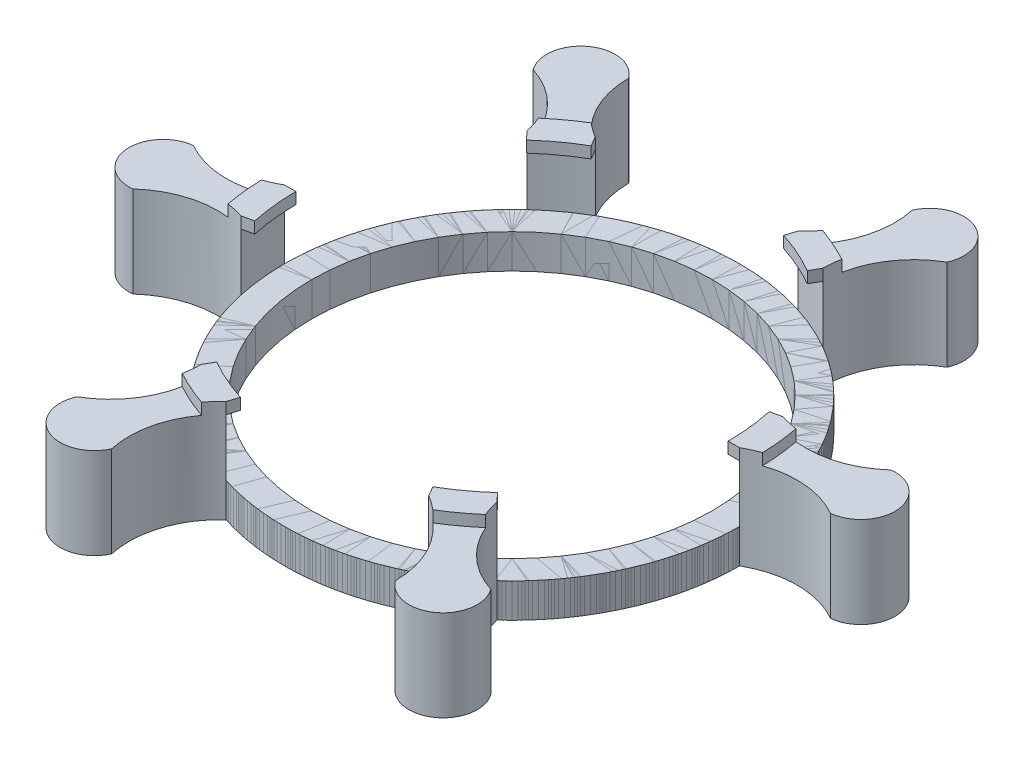
from build123d import *

# Parameters (mm, degrees)
SKETCH1_R                = 63.5
SKETCH1_R_2              = 55.88
BOSS_EXTRUDE1_DEPTH      = 9.525
BOSS_EXTRUDE2_DEPTH      = 15.875
BOSS_EXTRUDE2_DEPTH_BACK = 9.525
BOSS_EXTRUDE3_DEPTH      = 3.175
CIRPATTERN1_COUNT        = 6


with BuildPart() as part:
    # Sketch1 → Boss-Extrude1 (new body)
    with BuildSketch(Plane(origin=(0, 0, 0), x_dir=(1, 0, 0), z_dir=(0, 1, 0))):
        with Locations(Location((0, 0, 0), (0, 0, 90))):
            Circle(SKETCH1_R)
        with Locations(Location((0, 0, 0), (0, 0, 90))):
            Circle(SKETCH1_R_2, mode=Mode.SUBTRACT)
    extrude(amount=BOSS_EXTRUDE1_DEPTH)

    # Sketch2 → Boss-Extrude2 (add, two sides: drawn at the far end of the back side and taken through both)
    with BuildSketch(Plane(origin=(0, 9.525, 0), x_dir=(1, 0, 0), z_dir=(0, 1, 0)).offset(-BOSS_EXTRUDE2_DEPTH_BACK)):
        with BuildLine():
            ThreePointArc((62.042091837, 13.528815193), (75.175517225, 12.909752551), (86.858928571, 18.94034127))
            ThreePointArc((86.858928571, 18.94034127), (97.349634921, 10.490706349), (88.9, 0))
            ThreePointArc((88.9, 0), (76.2, 3.402954744), (63.5, 0))
            ThreePointArc((63.5, 0), (63.1344709, 6.803571429), (62.042091837, 13.528815193))
        make_face()
    extrude(amount=BOSS_EXTRUDE2_DEPTH + BOSS_EXTRUDE2_DEPTH_BACK)

    # Sketch3 → Boss-Extrude3 (add)
    with BuildSketch(Plane(origin=(0, 25.4, 0), x_dir=(1, 0, 0), z_dir=(0, 1, 0))):
        with BuildLine():
            Line((60.325, 0), (63.5, 0))
            ThreePointArc((63.5, 0), (65.659371798, 1.11258817), (67.915149907, 2.013811849))
            ThreePointArc((67.915149907, 2.013811849), (67.553883863, 7.279821429), (66.784920566, 12.501896255))
            ThreePointArc((66.784920566, 12.501896255), (64.388925587, 12.901830068), (62.042091837, 13.528815193))
            Line((62.042091837, 13.528815193), (58.939987245, 12.852374433))
            ThreePointArc((58.939987245, 12.852374433), (59.977747355, 6.463392857), (60.325, 0))
        make_face()
    extrude(amount=BOSS_EXTRUDE3_DEPTH)


with BuildPart() as cirpattern1_1:
    # CirPattern1: pattern copy
    add(part.part.rotate(Axis((0, 0, 0), (0, 1, 0)), 1 * 360 / CIRPATTERN1_COUNT))


with BuildPart() as cirpattern1_2:
    # CirPattern1: pattern copy
    add(part.part.rotate(Axis((0, 0, 0), (0, 1, 0)), 2 * 360 / CIRPATTERN1_COUNT))


with BuildPart() as cirpattern1_3:
    # CirPattern1: pattern copy
    add(part.part.rotate(Axis((0, 0, 0), (0, 1, 0)), 3 * 360 / CIRPATTERN1_COUNT))


with BuildPart() as cirpattern1_4:
    # CirPattern1: pattern copy
    add(part.part.rotate(Axis((0, 0, 0), (0, 1, 0)), 4 * 360 / CIRPATTERN1_COUNT))


with BuildPart() as cirpattern1_5:
    # CirPattern1: pattern copy
    add(part.part.rotate(Axis((0, 0, 0), (0, 1, 0)), 5 * 360 / CIRPATTERN1_COUNT))


solid = Compound([part.part, cirpattern1_1.part, cirpattern1_2.part, cirpattern1_3.part, cirpattern1_4.part, cirpattern1_5.part])
